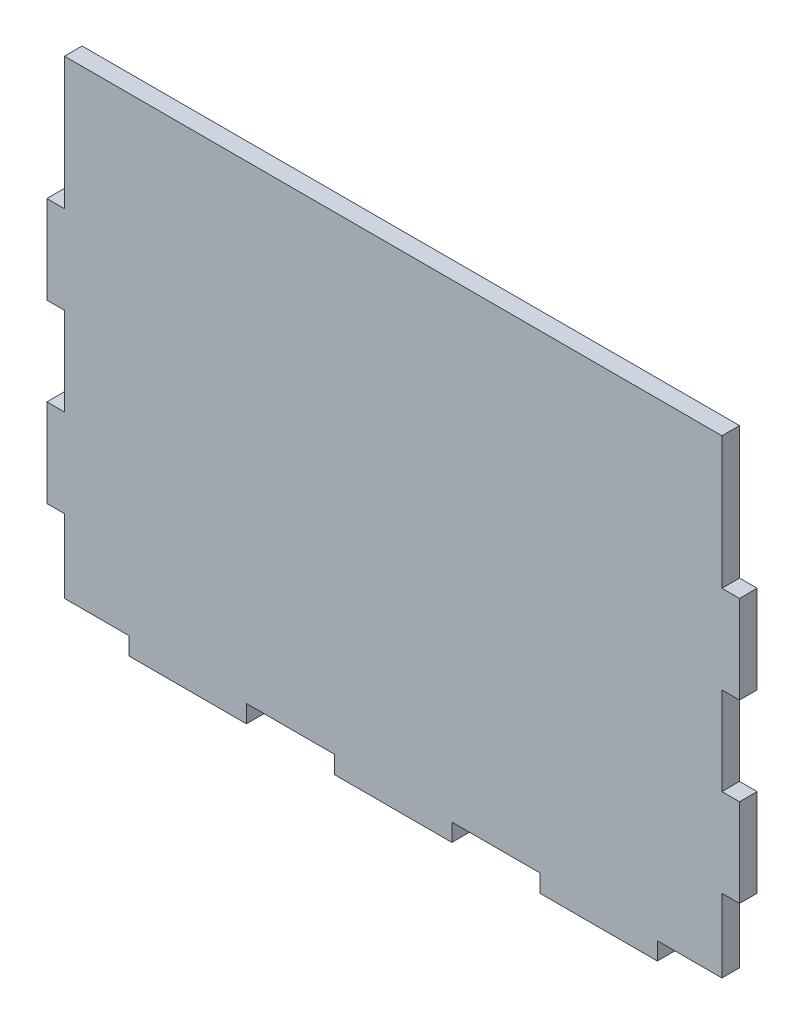
from build123d import *

# Parameters (mm, degrees)
SKETCH2_W           = 20
SKETCH2_H           = 3
SKETCH2_W_2         = 3
SKETCH2_H_2         = 15
BOSS_EXTRUDE1_DEPTH = 3


with BuildPart() as part:
    # Sketch2 → Boss-Extrude1 (new body)
    with BuildSketch(Plane.XY):
        Polygon((45, -40), (56, -40), (56, -27.5), (56, -12.5), (56, 2.5), (-56, 2.5), (-56, -12.5), (-56, -27.5), (-56, -40), (-45, -40), (-25, -40), (-10, -40), (10, -40), (25, -40), align=None)
        with Locations((35, -41.5)):
            Rectangle(SKETCH2_W, SKETCH2_H)
        with Locations((57.5, -20)):
            Rectangle(SKETCH2_W_2, SKETCH2_H_2)
        with Locations((0, -41.5)):
            Rectangle(SKETCH2_W, SKETCH2_H)
        Polygon((-56, 2.5), (56, 2.5), (56, 17.5), (56, 40), (-56, 40), (-56, 17.5), align=None)
        with Locations((57.5, 10)):
            Rectangle(SKETCH2_W_2, SKETCH2_H_2)
        with Locations((-57.5, 10)):
            Rectangle(SKETCH2_W_2, SKETCH2_H_2)
        with Locations((-35, -41.5)):
            Rectangle(SKETCH2_W, SKETCH2_H)
        with Locations((-57.5, -20)):
            Rectangle(SKETCH2_W_2, SKETCH2_H_2)
    extrude(amount=BOSS_EXTRUDE1_DEPTH)


solid = part.part
